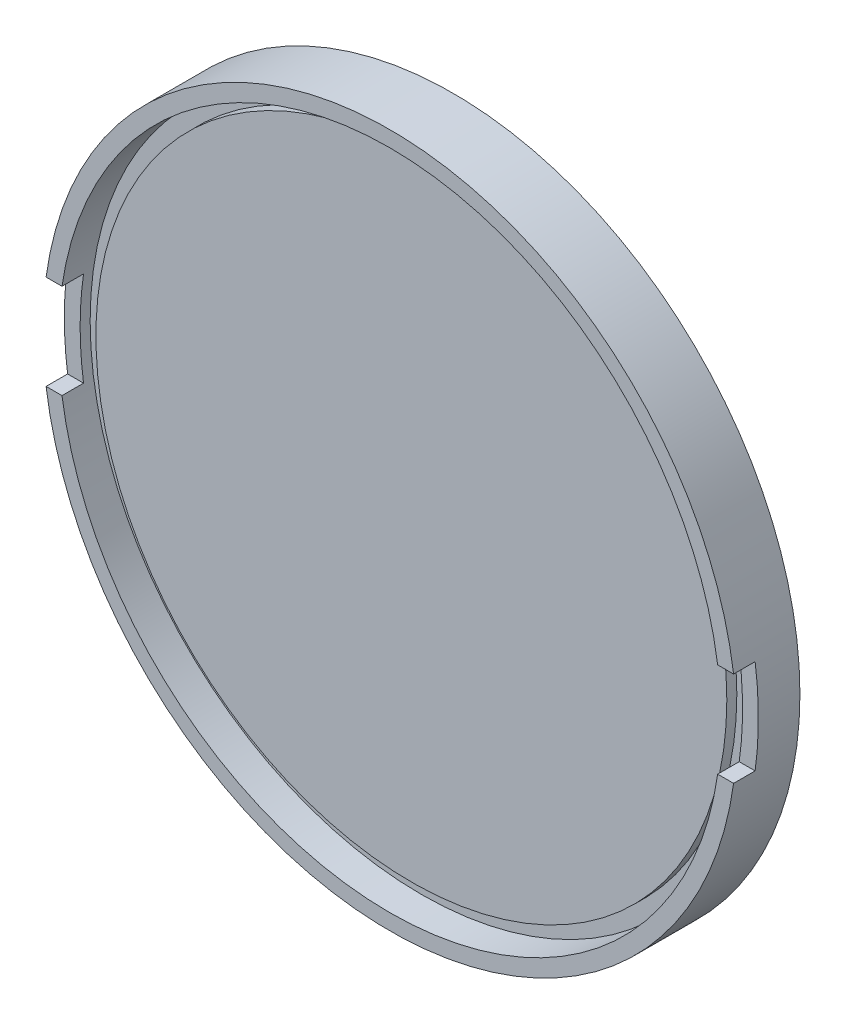
from build123d import *

# Parameters (mm, degrees)
SKETCH2_R               = 100
BASE_PLATE_DEPTH        = 3.175
SKETCH3_R               = 110
SKETCH3_R_2             = 105
BOSS_EXTRUDE2_DEPTH     = 10
SKETCH10_R              = 110
BOSS_EXTRUDE4_DEPTH     = 10
CUT_EXTRUDE2_DEPTH      = 156.884572681
CUT_EXTRUDE2_DEPTH_BACK = 156.884572681
SKETCH12_W              = 30
SKETCH12_H              = 6.825


with BuildPart() as part:
    # Sketch2 → Base Plate (new body)
    with BuildSketch(Plane(origin=(0, 0, 0), x_dir=(0, 1, 0), z_dir=(0, 0, 1))):
        with Locations(Location((0, 0, 0), (0, 0, 270))):
            Circle(SKETCH2_R)
    extrude(amount=BASE_PLATE_DEPTH)


with BuildPart() as body_2:
    # Sketch3 → Boss-Extrude2 (new body)
    with BuildSketch(Plane(origin=(0, 0, 0), x_dir=(1, 0, 0), z_dir=(0, 0, -1))):
        with Locations(Location((0, 0, 0), (0, 0, 180))):
            Circle(SKETCH3_R)
        with Locations(Location((0, 0, 0), (0, 0, 180))):
            Circle(SKETCH3_R_2, mode=Mode.SUBTRACT)
    extrude(amount=-BOSS_EXTRUDE2_DEPTH)

    # Sketch10 → Boss-Extrude4 (add)
    with BuildSketch(Plane(origin=(0, 0, 0), x_dir=(1, 0, 0), z_dir=(0, 0, -1))):
        with Locations(Location((0, 0, 0), (0, 0, 180))):
            Circle(SKETCH10_R)
    extrude(amount=BOSS_EXTRUDE4_DEPTH)

    # Sketch12 → Cut-Extrude2 (cut, two sides: drawn at the far end of the back side and taken through both)
    with BuildSketch(Plane.YZ.offset(-CUT_EXTRUDE2_DEPTH_BACK)):
        with Locations((0, 6.5875)):
            Rectangle(SKETCH12_W, SKETCH12_H)
    extrude(amount=CUT_EXTRUDE2_DEPTH + CUT_EXTRUDE2_DEPTH_BACK, mode=Mode.SUBTRACT)


solid = Compound([part.part, body_2.part])
